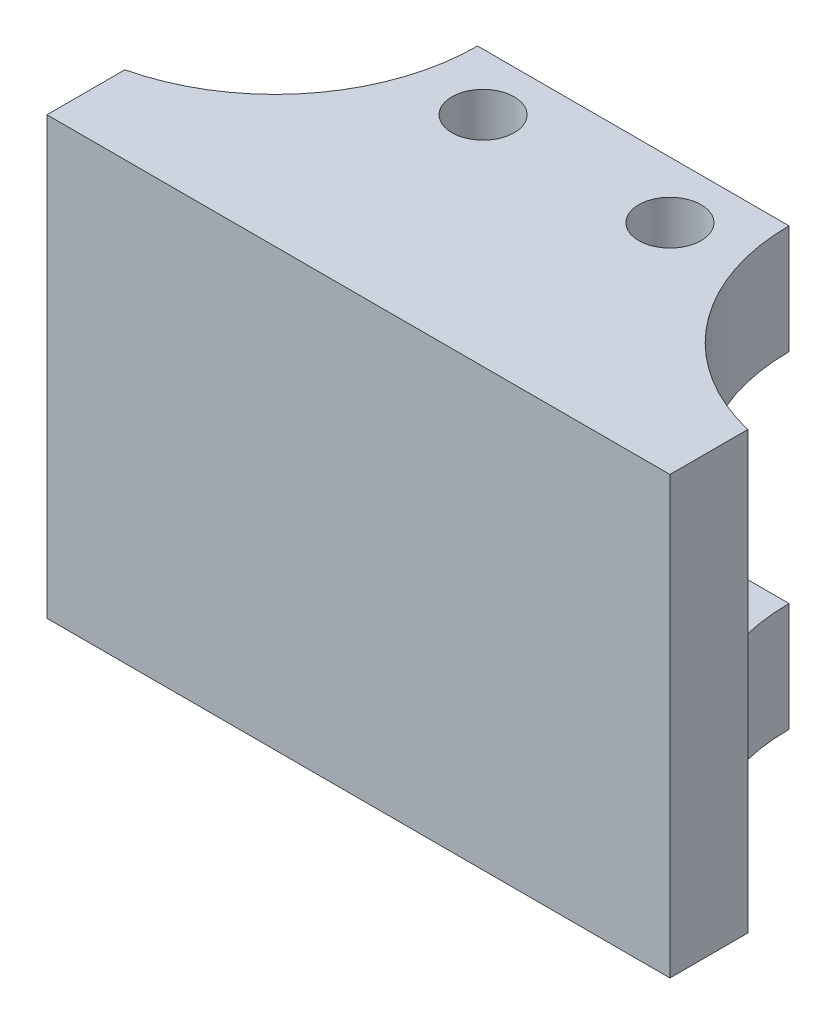
from build123d import *

# Parameters (mm, degrees)
SKETCH2_W                = 400
SKETCH2_H                = 280
BOSS_EXTRUDE1_DEPTH      = 50
BOSS_EXTRUDE2_DEPTH      = 140
BOSS_EXTRUDE2_DEPTH_BACK = 140
CUT_EXTRUDE1_DEPTH       = 200
CUT_EXTRUDE1_DEPTH_BACK  = 200
SKETCH5_W                = 126.470213754
SKETCH5_H                = 140
CUT_EXTRUDE2_DEPTH       = 200
CUT_EXTRUDE2_DEPTH_BACK  = 200
SKETCH6_R                = 20


with BuildPart() as part:
    # Sketch2 → Boss-Extrude1 (new body)
    with BuildSketch(Plane.XY):
        Rectangle(SKETCH2_W, SKETCH2_H)
    extrude(amount=BOSS_EXTRUDE1_DEPTH)

    # Sketch4 → Boss-Extrude2 (add, two sides: drawn at the far end of the back side and taken through both)
    with BuildSketch(Plane(origin=(0, 0, 0), x_dir=(1, 0, 0), z_dir=(0, 1, 0)).offset(-BOSS_EXTRUDE2_DEPTH_BACK)):
        with BuildLine():
            Line((-100, 126.470213754), (100, 126.470213754))
            ThreePointArc((100, 126.470213754), (128.020392375, 45.855830783), (200, 0))
            Line((200, 0), (100, 0))
            Line((100, 0), (-100, 0))
            Line((-100, 0), (-200, 0))
            ThreePointArc((-200, 0), (-128.020392375, 45.855830783), (-100, 126.470213754))
        make_face()
    extrude(amount=BOSS_EXTRUDE2_DEPTH + BOSS_EXTRUDE2_DEPTH_BACK)

    # Sketch5 → Cut-Extrude1 (cut, two sides: drawn at the far end of the back side and taken through both)
    with BuildSketch(Plane(origin=(0, 0, 0), x_dir=(0, 0, -1), z_dir=(1, 0, 0)).offset(-CUT_EXTRUDE1_DEPTH_BACK)):
        with Locations((63.235106877, 0)):
            Rectangle(SKETCH5_W, SKETCH5_H)
    extrude(amount=CUT_EXTRUDE1_DEPTH + CUT_EXTRUDE1_DEPTH_BACK, mode=Mode.SUBTRACT)

    # Sketch6 → Cut-Extrude2 (cut, two sides: drawn at the far end of the back side and taken through both)
    with BuildSketch(Plane(origin=(0, 0, 0), x_dir=(1, 0, 0), z_dir=(0, 1, 0)).offset(-CUT_EXTRUDE2_DEPTH_BACK)):
        with Locations(Location((-60, 90, 0), (0, 0, 270))):
            Circle(SKETCH6_R)
        with Locations(Location((60, 90, 0), (0, 0, 270))):
            Circle(SKETCH6_R)
    extrude(amount=CUT_EXTRUDE2_DEPTH + CUT_EXTRUDE2_DEPTH_BACK, mode=Mode.SUBTRACT)


solid = part.part
